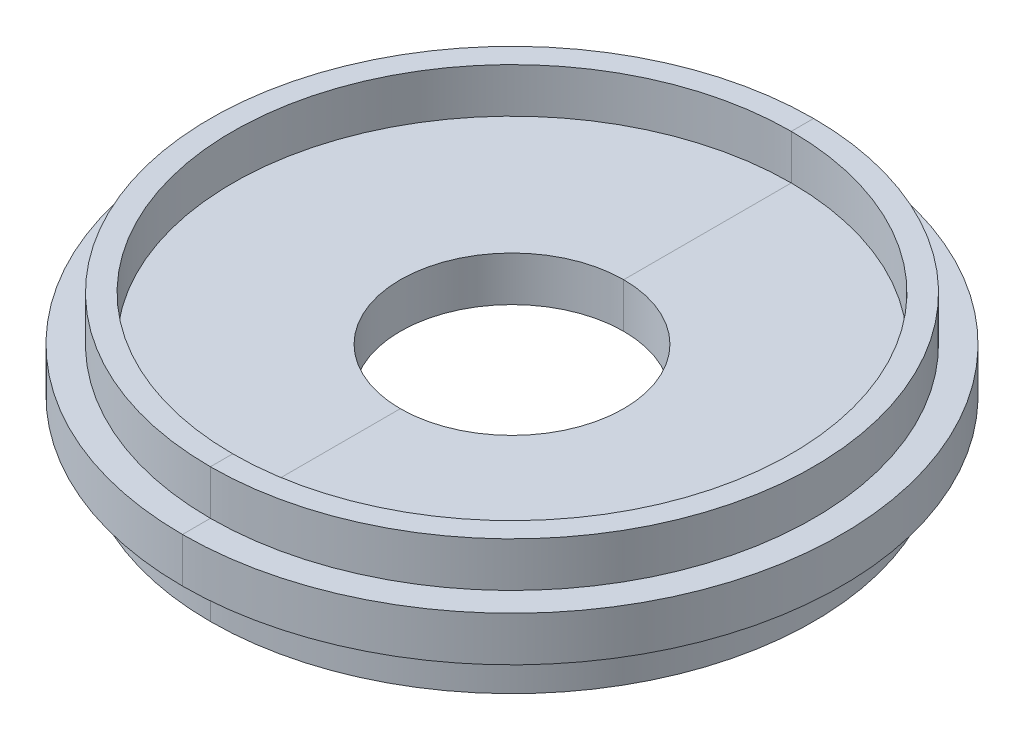
from build123d import *

# Parameters (mm, degrees)
SKETCH1_R            = 93.6625
SKETCH1_R_2          = 31.75
BOSS_EXTRUDE1_DEPTH  = 6.35
SKETCH5_R            = 85.725
SKETCH5_R_2          = 79.375
BOSS_EXTRUDE2_DEPTH  = 12.7
BOSS_EXTRUDE3_DEPTH  = 25.4
MIRROR5_COPY_1_DEPTH = 25.4
MIRROR5_COPY_2_DEPTH = 25.4


with BuildPart() as part:
    # Sketch1 → Boss-Extrude1 (new, symmetric)
    with BuildSketch(Plane(origin=(0, 0, 0), x_dir=(1, 0, 0), z_dir=(0, 1, 0))):
        with Locations(Location((0, 0, 0), (0, 0, 270))):
            Circle(SKETCH1_R)
        with Locations(Location((0, 0, 0), (0, 0, 270))):
            Circle(SKETCH1_R_2, mode=Mode.SUBTRACT)
    extrude(amount=BOSS_EXTRUDE1_DEPTH, both=True)

    # Sketch5 → Boss-Extrude2 (add)
    with BuildSketch(Plane(origin=(0, 6.35, 0), x_dir=(1, 0, 0), z_dir=(0, 1, 0))):
        with Locations(Location((0, 0, 0), (0, 0, 270))):
            Circle(SKETCH5_R)
        with Locations(Location((0, 0, 0), (0, 0, 270))):
            Circle(SKETCH5_R_2, mode=Mode.SUBTRACT)
    boss_extrude2 = extrude(amount=BOSS_EXTRUDE2_DEPTH)

    # Mirror1: Boss-Extrude2 across plane
    add(boss_extrude2.mirror(Plane.ZX))

    # Sketch7 → Boss-Extrude3 (add)
    with BuildSketch(Plane(origin=(0, 19.05, 0), x_dir=(1, 0, 0), z_dir=(0, 1, 0))):
        with BuildLine():
            Line((-25.787822327, 75.06916041), (-28.166257291, 80.965656764))
            ThreePointArc((-28.166257291, 80.965656764), (0, 85.725), (28.166257291, 80.965656764))
            Line((28.166257291, 80.965656764), (25.787822327, 75.06916041))
            ThreePointArc((25.787822327, 75.06916041), (0, 79.375), (-25.787822327, 75.06916041))
        make_face()
    boss_extrude3 = extrude(amount=-BOSS_EXTRUDE3_DEPTH)

    # Mirror3: Boss-Extrude3 across plane
    add(boss_extrude3.mirror(Plane.ZX))

    # Mirror4: Boss-Extrude3 across plane
    add(boss_extrude3.mirror(Plane.XY))

    # Mirror5 copy 1 sketch → Mirror5 copy 1 (add)
    with BuildSketch(Plane.XZ.offset(19.05)):
        with BuildLine():
            Line((-25.787822327, 75.06916041), (-28.166257291, 80.965656764))
            ThreePointArc((-28.166257291, 80.965656764), (0, 85.725), (28.166257291, 80.965656764))
            Line((28.166257291, 80.965656764), (25.787822327, 75.06916041))
            ThreePointArc((25.787822327, 75.06916041), (0, 79.375), (-25.787822327, 75.06916041))
        make_face()
    extrude(amount=-MIRROR5_COPY_1_DEPTH)

    # Mirror5 copy 2 sketch → Mirror5 copy 2 (add)
    with BuildSketch(Plane.XZ.offset(19.05)):
        with BuildLine():
            Line((-25.787822327, -75.06916041), (-28.166257291, -80.965656764))
            ThreePointArc((-28.166257291, -80.965656764), (0, -85.725), (28.166257291, -80.965656764))
            Line((28.166257291, -80.965656764), (25.787822327, -75.06916041))
            ThreePointArc((25.787822327, -75.06916041), (0, -79.375), (-25.787822327, -75.06916041))
        make_face()
    extrude(amount=-MIRROR5_COPY_2_DEPTH)


with BuildPart() as body_2:
    # Split1: the piece on the far side of the plane
    add(part.part)
    split(bisect_by=Plane(origin=(0, 0, 0), x_dir=(0, 0, 1), z_dir=(1, 0, 0)), keep=Keep.BOTTOM)


with BuildPart() as part_1:
    add(part.part)

    # Split1
    split(bisect_by=Plane(origin=(0, 0, 0), x_dir=(0, 0, 1), z_dir=(1, 0, 0)), keep=Keep.TOP)


solid = Compound([body_2.part, part_1.part])
